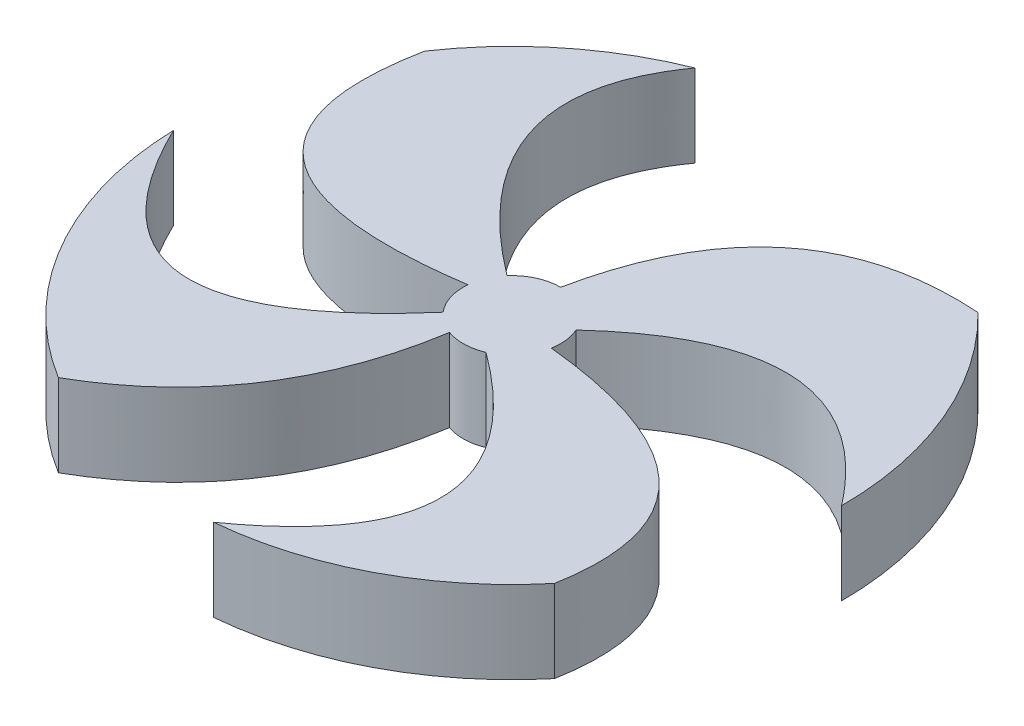
from build123d import *

# Parameters (mm, degrees)
BOSS_EXTRUDE2_DEPTH = 5


with BuildPart() as part:
    # Sketch3 → Boss-Extrude2 (new body)
    with BuildSketch(Plane(origin=(0, 0, 0), x_dir=(1, 0, 0), z_dir=(0, 1, 0))):
        with BuildLine():
            ThreePointArc((-2.946687169, 0.278195868), (-2.823196953, -0.888772849), (-2.255920315, -1.916032813))
            add(Edge.make_bspline(
                [(-2.255920315, -1.916032813), (-13.171337356, -14.504845087), (-19.982146303, -0.549733438)],
                knots=[0, 0, 0, 1, 1, 1], degree=2))
            ThreePointArc((-19.982146303, -0.549733438), (-17.317507753, -9.984603294), (-10.487312447, -17.017774689))
            add(Edge.make_bspline(
                [(-1.000187104, -2.785674778), (-2.546841566, -12.490182628), (-10.487312447, -17.017774689)],
                knots=[0, 0, 0, 1, 1, 1], degree=2))
            ThreePointArc((-1.000187104, -2.785674778), (0.084052871, -2.958596513), (1.156726663, -2.724397481))
            add(Edge.make_bspline(
                [(1.156726663, -2.724397481), (13.351165317, -11.711219241), (1.815860807, -19.907059734)],
                knots=[0, 0, 0, 1, 1, 1], degree=2))
            ThreePointArc((1.815860807, -19.907059734), (9.30002387, -17.694573568), (15.366618382, -12.784968409))
            add(Edge.make_bspline(
                [(2.913240883, -0.522863047), (17.317700847, -1.946688078), (15.366618382, -12.784968409)],
                knots=[0, 0, 0, 1, 1, 1], degree=2))
            ThreePointArc((2.913240883, -0.522863047), (2.939564994, 0.345421275), (2.712677202, 1.183951269))
            add(Edge.make_bspline(
                [(2.712677202, 1.183951269), (12.295659798, 10.008861874), (19.989706794, 0)],
                knots=[0, 0, 0, 1, 1, 1], degree=2))
            ThreePointArc((19.989706794, 0), (18.426097238, 7.750310851), (13.979881947, 14.288151681))
            add(Edge.make_bspline(
                [(0, 2.959790231), (2.474515592, 15.075911373), (13.979881947, 14.288151681)],
                knots=[0, 0, 0, 1, 1, 1], degree=2))
            ThreePointArc((0, 2.959790231), (-1.229068634, 2.692535702), (-2.236179538, 1.939035658))
            add(Edge.make_bspline(
                [(-2.236179538, 1.939035658), (-13.359480088, 10.340651394), (-7.448796697, 18.550035189)],
                knots=[0, 0, 0, 1, 1, 1], degree=2))
            ThreePointArc((-7.448796697, 18.550035189), (-12.533274778, 15.572584919), (-16.528834056, 11.242153818))
            add(Edge.make_bspline(
                [(-2.946687169, 0.278195868), (-19.130769908, -2.126973155), (-16.528834056, 11.242153818)],
                knots=[0, 0, 0, 1, 1, 1], degree=2))
        make_face()
    extrude(amount=BOSS_EXTRUDE2_DEPTH)


solid = part.part
